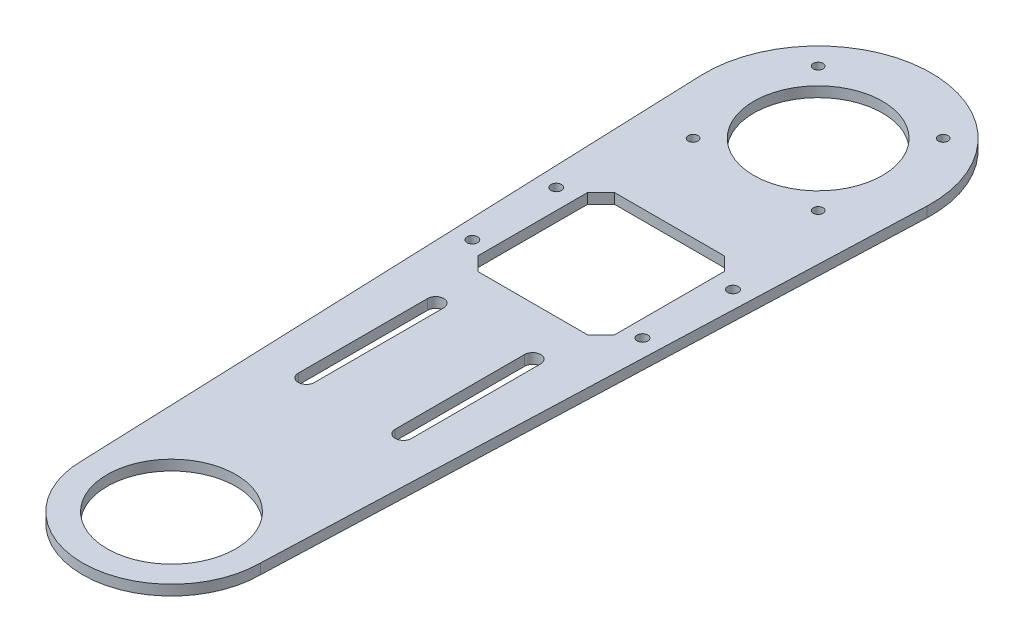
from build123d import *

# Parameters (mm, degrees)
BOSS_EXTRUDE1_DEPTH     = 3.175
SKETCH2_R               = 19.9
CUT_EXTRUDE1_DEPTH      = 140.49939292
ESQUISSE2_R             = 1.5
ENL_V_MAT_EXTRU_1_DEPTH = 140.49939292
SKETCH5_R               = 1.625
CUT_EXTRUDE3_DEPTH      = 140.49939292
CUT_EXTRUDE4_DEPTH      = 140.49939292


with BuildPart() as part:
    # Sketch1 → Boss-Extrude1 (new body)
    with BuildSketch(Plane(origin=(0, 0, 0), x_dir=(1, 0, 0), z_dir=(0, 1, 0))):
        with BuildLine():
            Line((-27.5, -100), (-34.975254116, 98.684097441))
            ThreePointArc((-34.975254116, 98.684097441), (0, 135), (34.975254116, 98.684097441))
            Line((34.975254116, 98.684097441), (27.5, -100))
            ThreePointArc((27.5, -100), (0, -127.5), (-27.5, -100))
        make_face()
    extrude(amount=BOSS_EXTRUDE1_DEPTH)

    # Sketch2 → Cut-Extrude1 (cut, through all)
    with BuildSketch(Plane(origin=(0, 3.175, 0), x_dir=(1, 0, 0), z_dir=(0, 1, 0))):
        with Locations(Location((0, -100, 0), (0, 0, 270))):
            Circle(SKETCH2_R)
        with Locations(Location((0, 100, 0), (0, 0, 270))):
            Circle(SKETCH2_R)
    extrude(amount=-CUT_EXTRUDE1_DEPTH, mode=Mode.SUBTRACT)

    # Esquisse2 → Enlèv. mat.-Extru.1 (cut, through all)
    with BuildSketch(Plane(origin=(0, 3.175, 0), x_dir=(1, 0, 0), z_dir=(0, 1, 0))):
        with Locations(Location((19.339370465, 80.660629535, 0), (0, 0, 270))):
            Circle(ESQUISSE2_R)
        with Locations(Location((19.339370465, 119.339370465, 0), (0, 0, 270))):
            Circle(ESQUISSE2_R)
        with Locations(Location((-19.339370465, 119.339370465, 0), (0, 0, 270))):
            Circle(ESQUISSE2_R)
        with Locations(Location((-19.339370465, 80.660629535, 0), (0, 0, 270))):
            Circle(ESQUISSE2_R)
    extrude(amount=-ENL_V_MAT_EXTRU_1_DEPTH, mode=Mode.SUBTRACT)

    # Sketch5 → Cut-Extrude3 (cut, through all)
    with BuildSketch(Plane(origin=(0, 3.175, 0), x_dir=(1, 0, 0), z_dir=(0, 1, 0))):
        with Locations(Location((-27.331724457, 46.340455159, 0), (0, 0, 270))):
            Circle(SKETCH5_R)
        with Locations(Location((-26.316599626, 19.359544841, 0), (0, 0, 270))):
            Circle(SKETCH5_R)
        with Locations(Location((26.316599626, 19.359544841, 0), (0, 0, 270))):
            Circle(SKETCH5_R)
        with Locations(Location((27.331724457, 46.340455159, 0), (0, 0, 270))):
            Circle(SKETCH5_R)
        Polygon((-21.15, 49.828069991), (-16.978069991, 54), (16.978069991, 54), (21.15, 49.828069991), (21.15, 15.871930009), (16.978069991, 11.7), (-16.978069991, 11.7), (-21.15, 15.871930009), align=None)
    extrude(amount=-CUT_EXTRUDE3_DEPTH, mode=Mode.SUBTRACT)

    # Sketch7 → Cut-Extrude4 (cut, through all)
    with BuildSketch(Plane(origin=(0, 3.175, 0), x_dir=(1, 0, 0), z_dir=(0, 1, 0))):
        with BuildLine():
            Line((17.5, -43.3), (17.5, -3.3))
            ThreePointArc((17.5, -3.3), (15, -0.8), (12.5, -3.3))
            Line((12.5, -3.3), (12.5, -43.3))
            ThreePointArc((12.5, -43.3), (15, -45.8), (17.5, -43.3))
        make_face()
        with BuildLine():
            Line((-12.5, -43.3), (-12.5, -3.3))
            ThreePointArc((-12.5, -3.3), (-15, -0.8), (-17.5, -3.3))
            Line((-17.5, -3.3), (-17.5, -43.3))
            ThreePointArc((-17.5, -43.3), (-15, -45.8), (-12.5, -43.3))
        make_face()
    extrude(amount=-CUT_EXTRUDE4_DEPTH, mode=Mode.SUBTRACT)


solid = part.part
